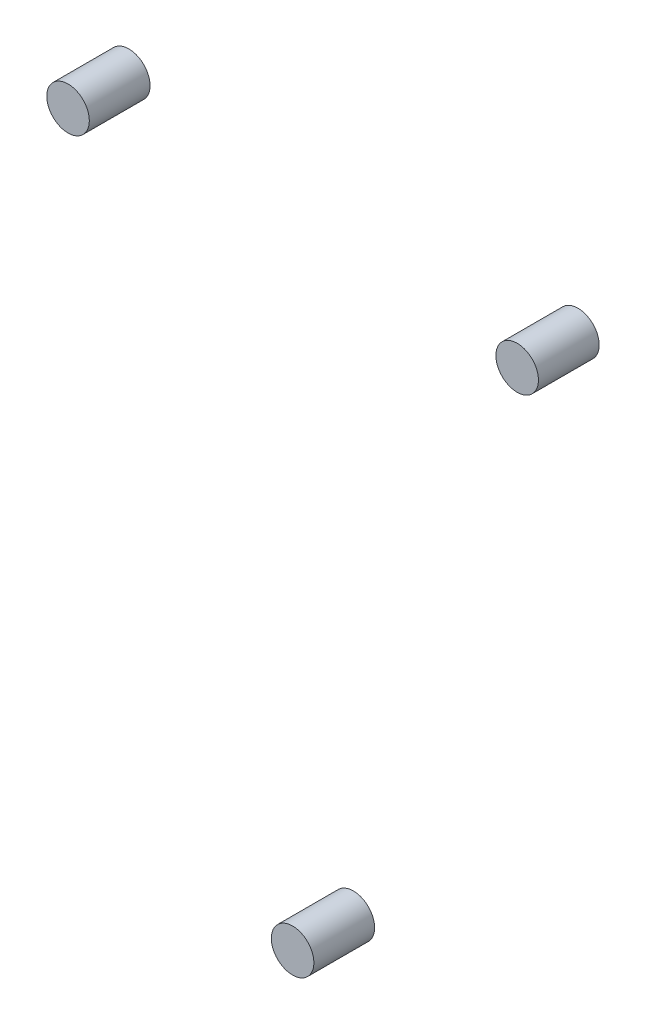
from build123d import *

# Parameters (mm, degrees)
SKETCH1_R             = 3.5
BOSS_EXTRUDE1_DEPTH   = 10
BOSS_EXTRUDE1_2_DEPTH = 10
BOSS_EXTRUDE1_3_DEPTH = 10


with BuildPart() as part:
    # Sketch1 → Boss-Extrude1 (new body)
    with BuildSketch(Plane.XY):
        with Locations((0, -57.5)):
            Circle(SKETCH1_R)
    extrude(amount=BOSS_EXTRUDE1_DEPTH)


with BuildPart() as body_2:
    # Sketch1 → Boss-Extrude1 2 (new body)
    with BuildSketch(Plane.XY):
        with Locations((-36.960287557, 44.047555479)):
            Circle(SKETCH1_R)
    extrude(amount=BOSS_EXTRUDE1_2_DEPTH)


with BuildPart() as body_3:
    # Sketch1 → Boss-Extrude1 3 (new body)
    with BuildSketch(Plane.XY):
        with Locations((36.960287557, 44.047555479)):
            Circle(SKETCH1_R)
    extrude(amount=BOSS_EXTRUDE1_3_DEPTH)


solid = Compound([part.part, body_2.part, body_3.part])
